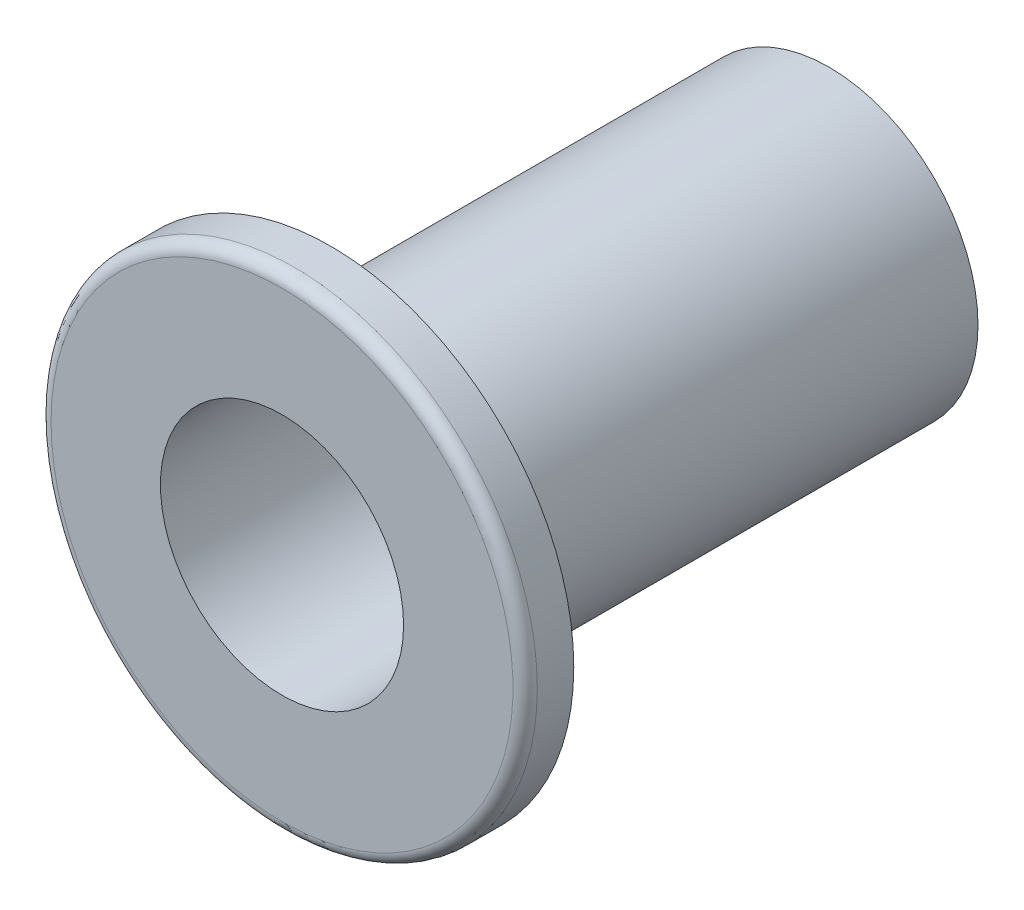
from build123d import *

# Parameters (mm, degrees)
FILLET_1_R = 0.2


with BuildPart() as part:
    # 草图1 → 旋转1 (revolve)
    with BuildSketch(Plane(origin=(0, 0, 0), x_dir=(0, 0, -1), z_dir=(1, 0, 0)), mode=Mode.PRIVATE) as revolve_1_sk:
        Polygon((0, 2.45), (0, 4), (-0.8, 4), (-0.8, 2), (3.7, 2), (3.7, 1.5), (8.2, 1.5), (8.2, 2.45), align=None)
    revolve(revolve_1_sk.sketch.rotate(Axis((0, 0, 0), (0, 0, -1)), 90), axis=Axis((0, 0, 0), (0, 0, -1)))

    # 圆角1
    fillet_1_edges = [part.edges().sort_by_distance(p)[0] for p in [
        (-4, 0, 0.8),
    ]]
    fillet(fillet_1_edges, radius=FILLET_1_R)


solid = part.part
